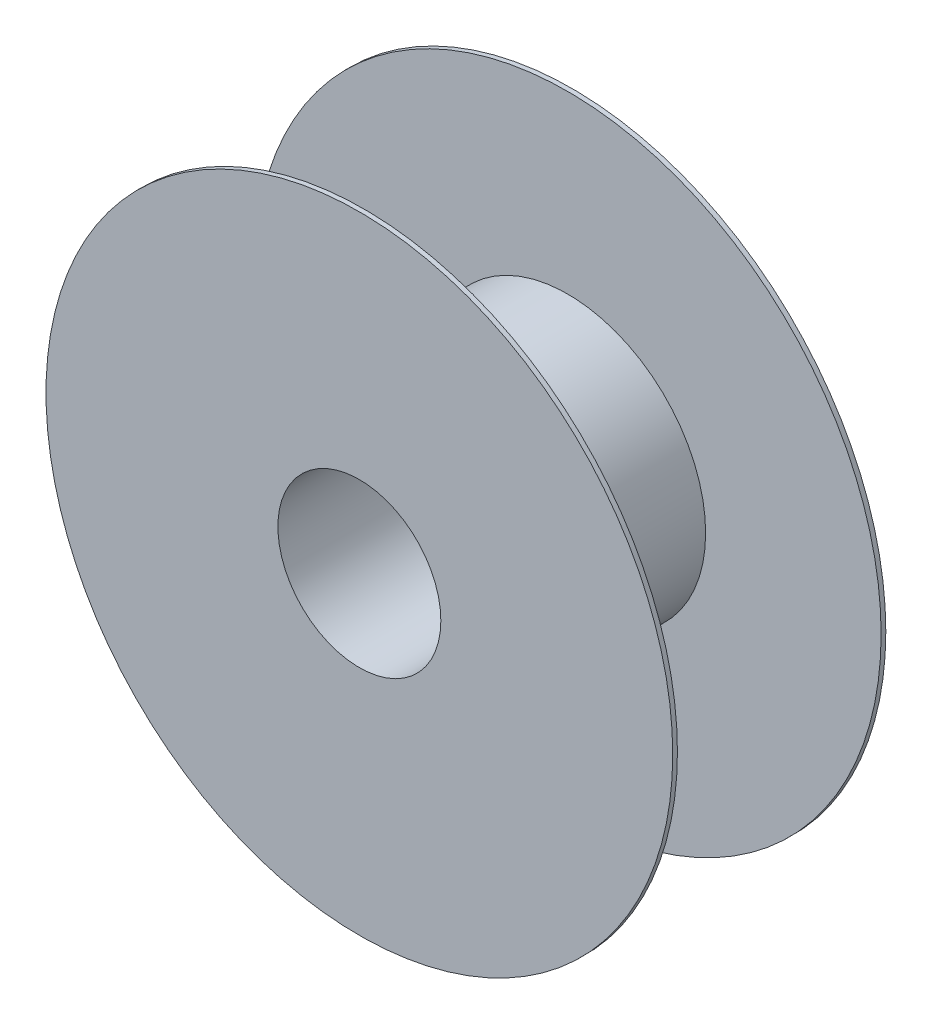
from build123d import *

# Parameters (mm, degrees)
ESBO_O1_R                = 100
ESBO_O1_R_2              = 26
RESSALTO_EXTRUS_O1_DEPTH = 1.5
ESBO_O1_3_R              = 44
ESBO_O1_3_R_2            = 26
RESSALTO_EXTRUS_O2_DEPTH = 34


with BuildPart() as part:
    # Esboço1 → Ressalto-extrusão1 (new body)
    with BuildSketch(Plane.XY):
        Circle(ESBO_O1_R)
        Circle(ESBO_O1_R_2, mode=Mode.SUBTRACT)
    extrude(amount=-RESSALTO_EXTRUS_O1_DEPTH)

    # Esboço1<3> → Ressalto-extrusão2 (add)
    with BuildSketch(Plane.XY):
        Circle(ESBO_O1_3_R)
        Circle(ESBO_O1_3_R_2, mode=Mode.SUBTRACT)
    extrude(amount=-RESSALTO_EXTRUS_O2_DEPTH)

    # Espelhar1: part across plane


with BuildPart() as part_1:
    add(part.part)
    add(part.part.mirror(Plane(origin=(0, 0, -34), x_dir=(1, 0, 0), z_dir=(0, 0, -1))))


solid = part_1.part
